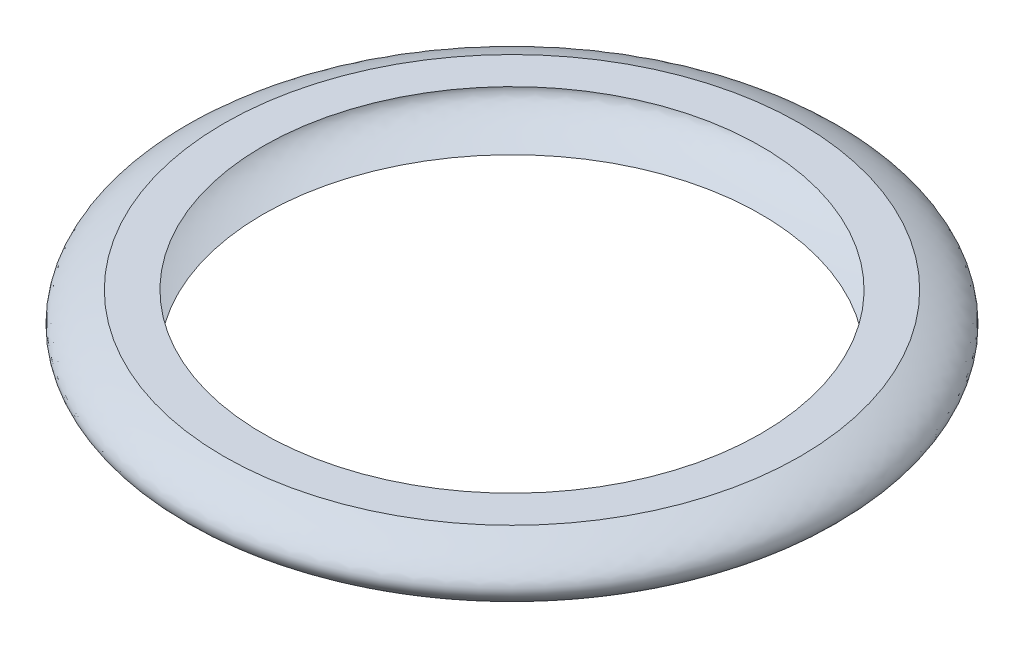
from build123d import *


with BuildPart() as part:
    # Sketch2 → Revolve1 (revolve)
    with BuildSketch(Plane.XY):
        with BuildLine():
            Line((-31.665, 7.5), (-36.665, 7.5))
            add(Edge.make_bspline(
                [(-36.665, 0), (-47.165, 3.75), (-36.665, 7.5)],
                knots=[0, 0, 0, 1, 1, 1], degree=2))
            Line((-36.665, 0), (-31.665, 0))
            add(Edge.make_bspline(
                [(-31.665, 0), (-42.165, 3.75), (-31.665, 7.5)],
                knots=[0, 0, 0, 1, 1, 1], degree=2))
        make_face()
    revolve(axis=Axis((0, 7.5, 0), (0, -1, 0)))


solid = part.part
